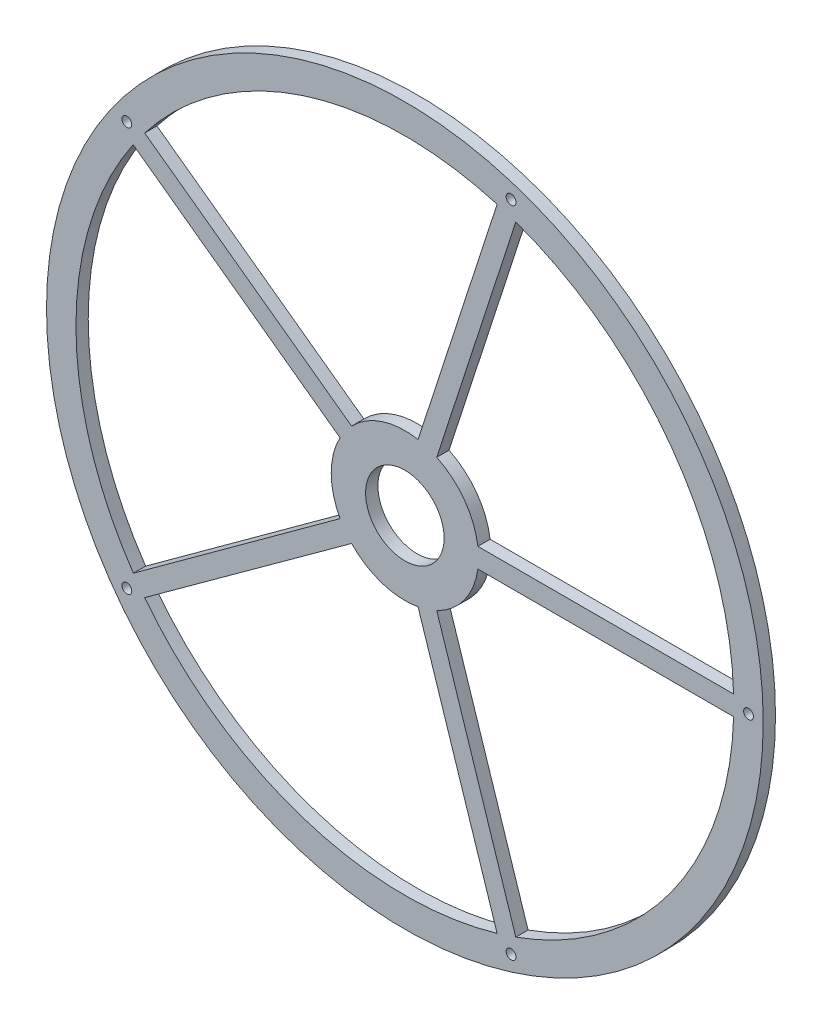
from build123d import *

# Parameters (mm, degrees)
SKETCH_3_R          = 73
EXTRUDE_3_DEPTH     = 2.5
SKETCH_5_R          = 67
CUT_EXTRUDE_1_DEPTH = 2.5
SKETCH_6_R          = 15
EXTRUDE_4_DEPTH     = 2.5
SKETCH_7_R          = 8
CUT_EXTRUDE_2_DEPTH = 2.5
EXTRUDE_6_DEPTH     = 2.5
EXTRUDE_7_DEPTH     = 2.5
EXTRUDE_8_DEPTH     = 2.5
EXTRUDE_9_DEPTH     = 2.5
EXTRUDE_10_DEPTH    = 2.5
SKETCH_14_R         = 8
CUT_EXTRUDE_3_DEPTH = 2.5
SKETCH_15_R         = 1
CUT_EXTRUDE_4_DEPTH = 2.5


with BuildPart() as part:
    # 草图3 → 凸台-拉伸3 (new body)
    with BuildSketch(Plane.XY):
        Circle(SKETCH_3_R)
    extrude(amount=EXTRUDE_3_DEPTH)

    # 草图5 → 切除-拉伸1 (cut)
    with BuildSketch(Plane.XY.offset(2.5)):
        Circle(SKETCH_5_R)
    extrude(amount=-CUT_EXTRUDE_1_DEPTH, mode=Mode.SUBTRACT)



with BuildPart() as body_2:
    # 草图6 → 凸台-拉伸4 (new body)
    with BuildSketch(Plane.XY.offset(2.5)):
        Circle(SKETCH_6_R)
    extrude(amount=-EXTRUDE_4_DEPTH)

    # 草图7 → 切除-拉伸2 (cut)
    with BuildSketch(Plane.XY.offset(2.5)):
        Circle(SKETCH_7_R)
    extrude(amount=-CUT_EXTRUDE_2_DEPTH, mode=Mode.SUBTRACT)


with BuildPart() as part_1:
    add(part.part)

    add(body_2.part)  # 凸台-拉伸6 merges body 2
    # 草图9 → 凸台-拉伸6 (add)
    with BuildSketch(Plane.XY.offset(2.5)):
        with BuildLine():
            Line((0, 2), (0, 0))
            Line((0, 0), (0, -2))
            Line((0, -2), (66.970142601, -2))
            ThreePointArc((66.970142601, -2), (67, 0), (66.970142601, 2))
            Line((66.970142601, 2), (0, 2))
        make_face()
    extrude(amount=-EXTRUDE_6_DEPTH)

    # 草图10 → 凸台-拉伸7 (add)
    with BuildSketch(Plane.XY.offset(2.5)):
        with BuildLine():
            Line((1.902113033, -0.618033989), (0, 0))
            Line((0, 0), (-1.902113033, 0.618033989))
            Line((-1.902113033, 0.618033989), (18.792799147, 64.310424507))
            ThreePointArc((18.792799147, 64.310424507), (20.704138623, 63.720786592), (22.597025212, 63.074356529))
            Line((22.597025212, 63.074356529), (1.902113033, -0.618033989))
        make_face()
    extrude(amount=-EXTRUDE_7_DEPTH)

    # 草图11 → 凸台-拉伸8 (add)
    with BuildSketch(Plane.XY.offset(2.5)):
        with BuildLine():
            Line((0, 0), (1.175570505, 1.618033989))
            Line((1.175570505, 1.618033989), (-53.004412975, 40.982096154))
            ThreePointArc((-53.004412975, 40.982096154), (-54.204138623, 39.381611904), (-55.355553985, 37.746028176))
            Line((-55.355553985, 37.746028176), (-1.175570505, -1.618033989))
            Line((-1.175570505, -1.618033989), (0, 0))
        make_face()
    extrude(amount=-EXTRUDE_8_DEPTH)

    # 草图12 → 凸台-拉伸9 (add)
    with BuildSketch(Plane.XY.offset(2.5)):
        with BuildLine():
            Line((0, 0), (1.175570505, -1.618033989))
            Line((1.175570505, -1.618033989), (-53.004412975, -40.982096154))
            ThreePointArc((-53.004412975, -40.982096154), (-54.176759621, -39.419268347), (-55.30304181, -37.822923823))
            Line((-55.30304181, -37.822923823), (-1.175570505, 1.618033989))
            Line((-1.175570505, 1.618033989), (0, 0))
        make_face()
    extrude(amount=-EXTRUDE_9_DEPTH)

    # 草图13 → 凸台-拉伸10 (add)
    with BuildSketch(Plane.XY.offset(2.5)):
        with BuildLine():
            Line((0, 0), (1.902113033, 0.618033989))
            Line((1.902113033, 0.618033989), (22.597025212, -63.074356529))
            ThreePointArc((22.597025212, -63.074356529), (20.704138623, -63.720786592), (18.792799147, -64.310424507))
            Line((18.792799147, -64.310424507), (-1.902113033, -0.618033989))
            Line((-1.902113033, -0.618033989), (0, 0))
        make_face()
    extrude(amount=-EXTRUDE_10_DEPTH)

    # 草图14 → 切除-拉伸3 (cut)
    with BuildSketch(Plane.XY.offset(2.5)):
        Circle(SKETCH_14_R)
    extrude(amount=-CUT_EXTRUDE_3_DEPTH, mode=Mode.SUBTRACT)

    # 草图15 → 切除-拉伸4 (cut)
    with BuildSketch(Plane.XY.offset(2.5)):
        with Locations((70, 0)):
            Circle(SKETCH_15_R)
        with Locations((21.631189606, 66.573956141)):
            Circle(SKETCH_15_R)
        with Locations((-56.631189606, 41.14496766)):
            Circle(SKETCH_15_R)
        with Locations((-56.631189606, -41.14496766)):
            Circle(SKETCH_15_R)
        with Locations((21.631189606, -66.573956141)):
            Circle(SKETCH_15_R)
    extrude(amount=-CUT_EXTRUDE_4_DEPTH, mode=Mode.SUBTRACT)


solid = part_1.part
